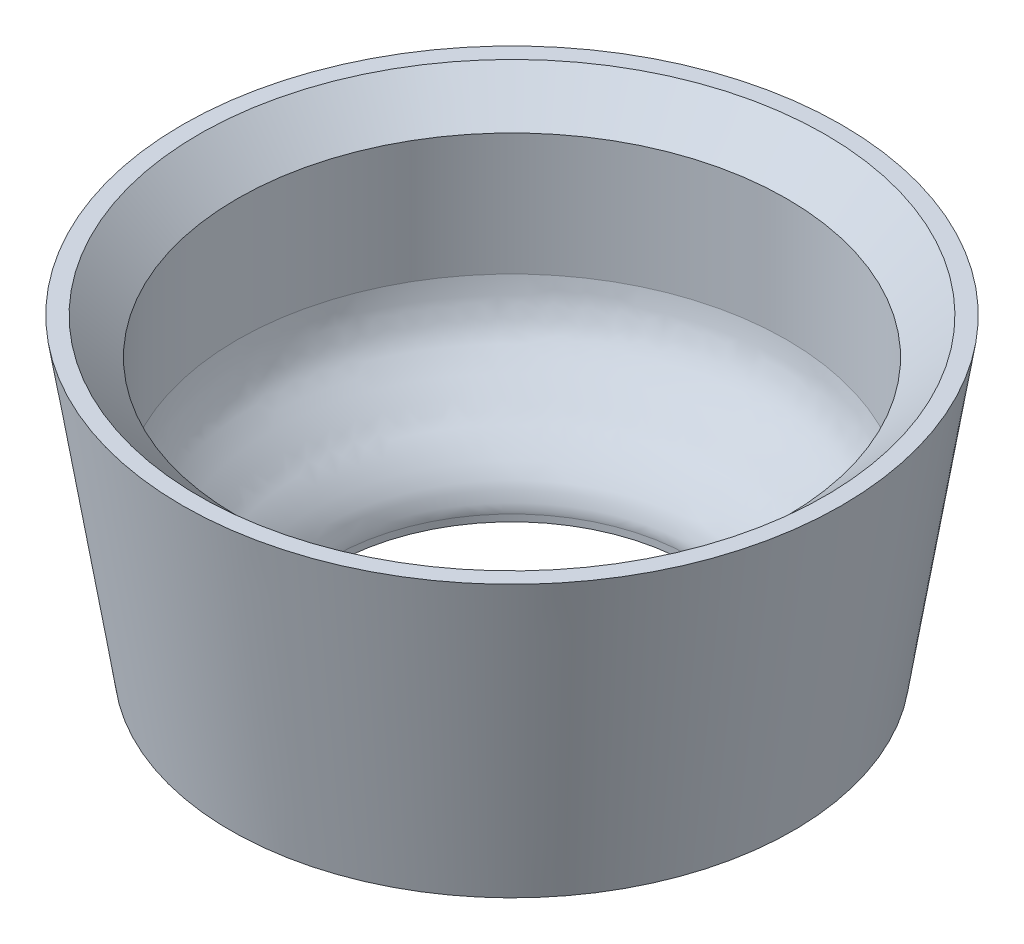
from build123d import *


with BuildPart() as part:
    # cup → Revolve10 (revolve)
    with BuildSketch(Plane(origin=(0, 0, 0), x_dir=(0, 0, -1), z_dir=(1, 0, 0))):
        with BuildLine():
            Line((26.3877562, 273.977978152), (41.393848749, 273.977978152))
            Line((41.393848749, 273.977978152), (48.521369999, 318.979376237))
            Line((48.521369999, 318.979376237), (46.09278776, 318.979376237))
            Line((46.09278776, 318.979376237), (40.434998933, 313.610335114))
            Line((40.434998933, 313.610335114), (40.434998933, 302.929125624))
            Line((40.434998933, 302.929125624), (40.435001067, 295.628098891))
            add(Edge.make_bspline(
                [(26.3877562, 274.977978152), (26.308069584, 275.856710536), (26.796830662, 277.02873066), (27.443781617, 278.556908896), (28.356699811, 279.511909602), (29.160414421, 280.515150439), (30.174182206, 281.464372876), (31.066815667, 282.438718878), (32.170131949, 283.286750944), (33.123255367, 284.296585872), (34.13106238, 285.346264322), (35.274047285, 286.251458493), (36.223208535, 287.265101835), (37.219500197, 288.227943348), (38.14175611, 289.239215424), (38.901851681, 290.459887567), (39.40949031, 291.690068117), (40.087968636, 293.371695279), (40.264723453, 294.719186571), (40.435001067, 295.628098891)],
                knots=[0, 0, 0, 0, 0.098127883, 0.147997761, 0.191547501, 0.250818037, 0.298129775, 0.35332526, 0.404730279, 0.459927689, 0.515124716, 0.574396505, 0.629590541, 0.67690421, 0.736176363, 0.788774743, 0.843690475, 0.891327752, 1, 1, 1, 1], degree=3))
            Line((26.3877562, 274.977978152), (26.3877562, 273.977978152))
        make_face()
    revolve(axis=Axis((0, 0, 0), (0, 1, 0)))


solid = part.part
